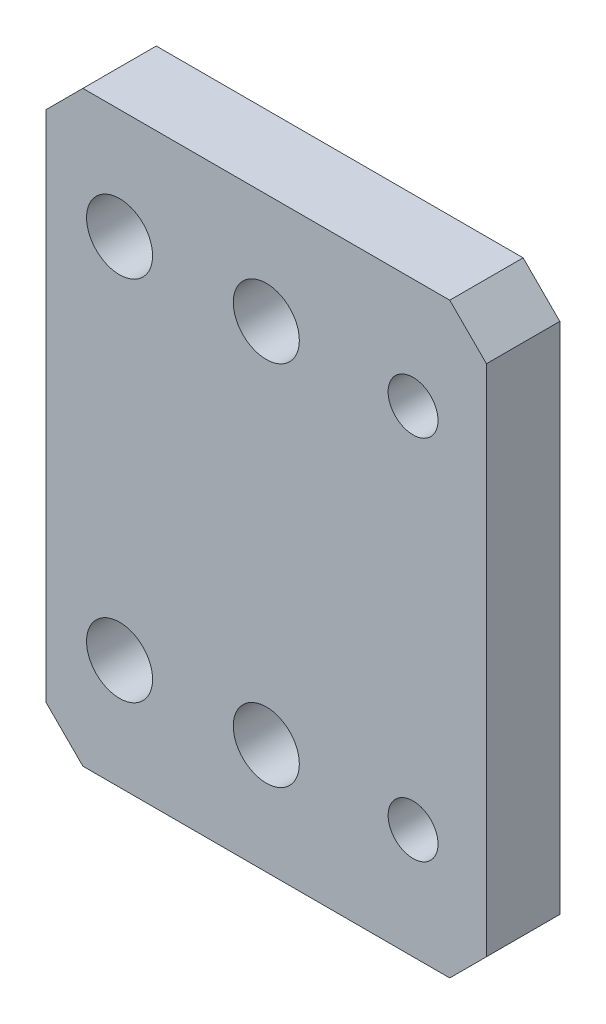
from build123d import *

# Parameters (mm, degrees)
SKETCH_1_W                = 60
SKETCH_1_H                = 80
EXTRUDE_1_DEPTH           = 10
CHAMFER_1_SIZE            = 5
HOLE_WIZARD_9_0_9_1_D     = 9
HOLE_WIZARD_9_0_9_1_DEPTH = 34.5
HOLE_WIZARD_9_0_9_1_TIP   = 2.703872786
HOLE_WIZARD_M8_3_D        = 6.8
HOLE_WIZARD_M8_3_DEPTH    = 22.25
HOLE_WIZARD_M8_3_TIP      = 2.042926105


with BuildPart() as part:
    # 草图1 → 凸台-拉伸1 (new body)
    with BuildSketch(Plane.XY):
        with Locations((-10, 0)):
            Rectangle(SKETCH_1_W, SKETCH_1_H)
    extrude(amount=EXTRUDE_1_DEPTH)

    # 倒角1
    chamfer_1_edges = [part.edges().sort_by_distance(p)[0] for p in [
        (20, -40, 5),
        (-40, -40, 5),
        (-40, 40, 5),
        (20, 40, 5),
    ]]
    chamfer(chamfer_1_edges, length=CHAMFER_1_SIZE)

    # Ø9.0 (9) 直径孔1
    with Locations(Plane.XY.offset(10)):
        with Locations((-30, 25), (-30, -25), (-10, -25), (-10, 25)):
            Hole(HOLE_WIZARD_9_0_9_1_D / 2, depth=HOLE_WIZARD_9_0_9_1_DEPTH)
            with Locations((0, 0, -(HOLE_WIZARD_9_0_9_1_DEPTH + HOLE_WIZARD_9_0_9_1_TIP / 2))):  # 118° drill point
                Cone(0, HOLE_WIZARD_9_0_9_1_D / 2, HOLE_WIZARD_9_0_9_1_TIP, mode=Mode.SUBTRACT)

    # M8 螺纹孔3
    with Locations(Plane.XY.offset(10)):
        with Locations((10, -25), (10, 25)):
            Hole(HOLE_WIZARD_M8_3_D / 2, depth=HOLE_WIZARD_M8_3_DEPTH)
            with Locations((0, 0, -(HOLE_WIZARD_M8_3_DEPTH + HOLE_WIZARD_M8_3_TIP / 2))):  # 118° drill point
                Cone(0, HOLE_WIZARD_M8_3_D / 2, HOLE_WIZARD_M8_3_TIP, mode=Mode.SUBTRACT)


solid = part.part
